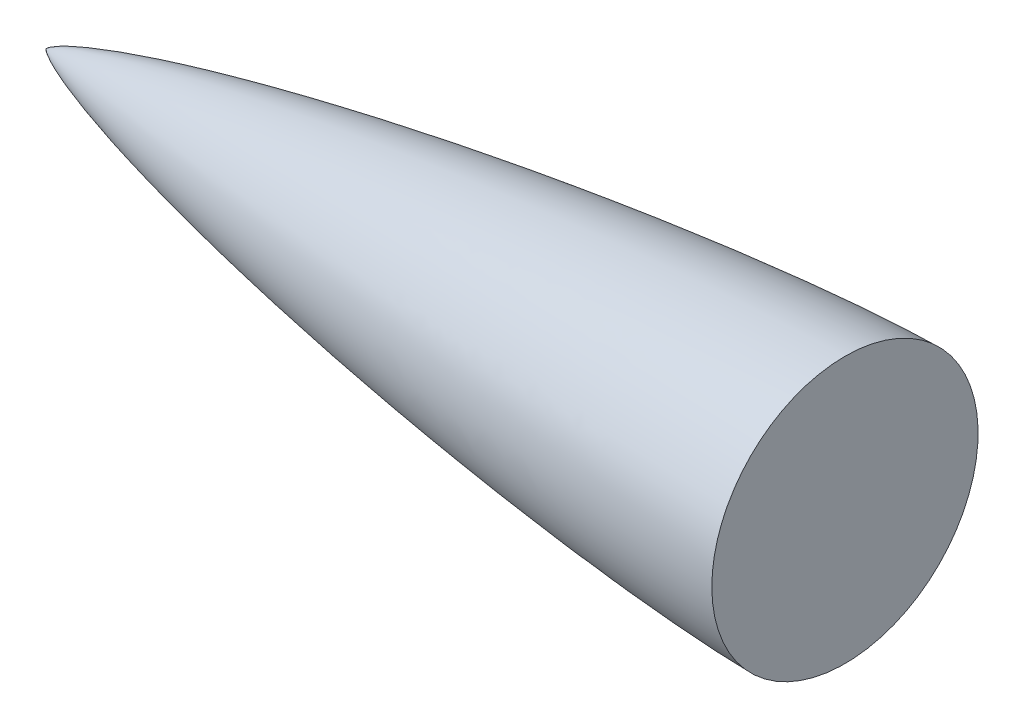
from build123d import *


with BuildPart() as part:
    # Sketch7 → Revolve7 (revolve)
    with BuildSketch(Plane.XY):
        with BuildLine():
            Line((0, 0), (18, 0))
            Line((18, 0), (18, 3))
            add(Edge.make_bspline(
                [(0, 0), (0.001263412, 0.003094352), (0.004325575, 0.008261734), (0.010354487, 0.014705547), (0.019526987, 0.023609988), (0.031709098, 0.033845948), (0.050687444, 0.048181132), (0.082893103, 0.069703118), (0.139413795, 0.103009404), (0.239926459, 0.15479475), (0.417857455, 0.234406133), (0.71731954, 0.350470877), (1.244566533, 0.527836288), (2.003611252, 0.74721866), (2.958555244, 0.989370662), (4.059733569, 1.238133841), (5.18667607, 1.46928195), (6.599865051, 1.735223846), (8.017826162, 1.974649424), (9.439446492, 2.191152564), (10.864194903, 2.385684676), (12.005709822, 2.52819926), (13.148833991, 2.657155946), (14.293494388, 2.771792374), (15.439652687, 2.870325286), (16.509500401, 2.944763651), (17.293379145, 2.983468626), (17.790396435, 2.998387761), (18, 3)],
                knots=[0, 0, 0, 0, 0, 0.00072651, 0.001316926, 0.001900325, 0.00279914, 0.004191326, 0.006507517, 0.010346165, 0.01710864, 0.028850703, 0.049024263, 0.080401341, 0.138458539, 0.201212696, 0.263966851, 0.326721012, 0.389475169, 0.514983492, 0.577737651, 0.640491811, 0.703245972, 0.766000132, 0.828754291, 0.891508451, 0.954262612, 1, 1, 1, 1, 1], degree=4))
        make_face()
    revolve(axis=Axis((0, 0, 0), (1, 0, 0)))


solid = part.part
